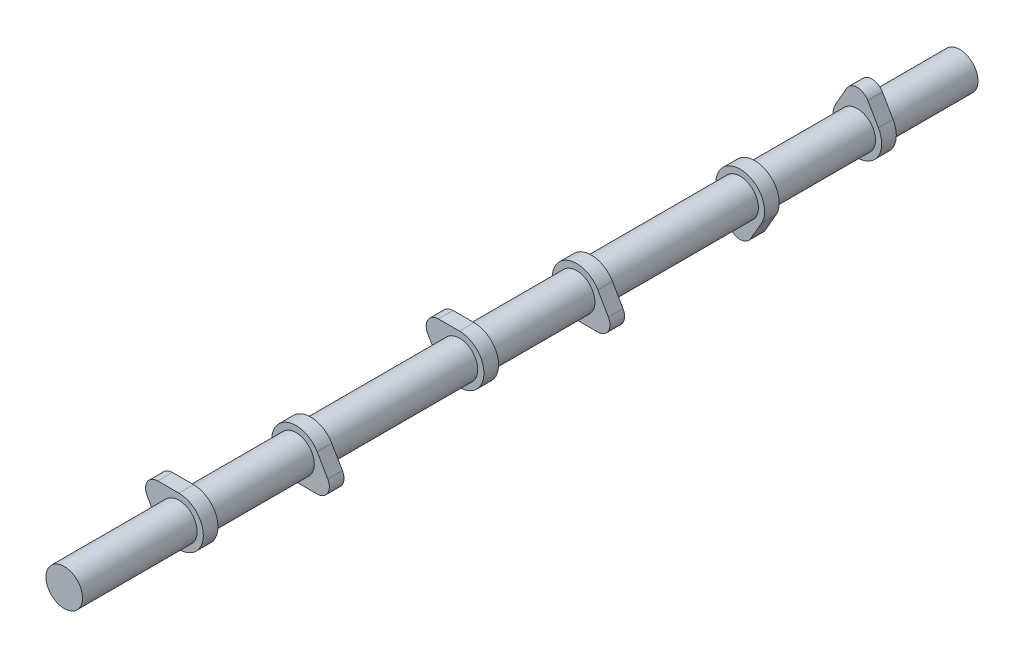
from build123d import *

# Parameters (mm, degrees)
BOSS_EXTRUDE1_DEPTH   = 3.81
BODY_MOVE_COPY2_ANGLE = 180
BOSS_EXTRUDE3_START   = -25.4
SKETCH2_R             = 9.5
BOSS_EXTRUDE3_DEPTH   = 146.05
LPATTERN1_COUNT       = 3
LPATTERN1_PITCH       = 146.05
BODY_MOVE_COPY3_ANGLE = 120
BODY_MOVE_COPY4_ANGLE = 120
MOVE_FACE1_BY         = 27.94


with BuildPart() as part:
    # Sketch1 → Boss-Extrude1 (new, symmetric)
    with BuildSketch(Plane.XY):
        with BuildLine():
            Line((-5.499261314, 15.875), (-10.998522628, 6.35))
            ThreePointArc((-10.998522628, 6.35), (0, -12.7), (10.998522628, 6.35))
            Line((10.998522628, 6.35), (5.499261314, 15.875))
            ThreePointArc((5.499261314, 15.875), (0, 19.05), (-5.499261314, 15.875))
        make_face()
    extrude(amount=BOSS_EXTRUDE1_DEPTH, both=True)


with BuildPart() as body_2:
    # Body-Move/Copy1: copy of part
    add(part.part.moved(Location((0, 0, 60.96))))


with BuildPart() as body_2_1:
    # Body-Move/Copy2: moved
    add(body_2.part.rotate(Axis((0, 0, 0), (0, 0, 1)), BODY_MOVE_COPY2_ANGLE))


with BuildPart() as body_3:
    # Sketch2 → Boss-Extrude3 (new body)
    with BuildSketch(Plane.XY.offset(3.81).offset(BOSS_EXTRUDE3_START)):
        Circle(SKETCH2_R)
    extrude(amount=BOSS_EXTRUDE3_DEPTH)


with BuildPart() as lpattern1_1:
    # LPattern1: pattern copy
    add(body_3.part.moved(Location(Vector(0, 0, 1) * (1 * LPATTERN1_PITCH))))


with BuildPart() as lpattern1_2:
    # LPattern1: pattern copy
    add(body_3.part.moved(Location(Vector(0, 0, 1) * (2 * LPATTERN1_PITCH))))


with BuildPart() as lpattern1_3:
    # LPattern1: pattern copy
    add(part.part.moved(Location(Vector(0, 0, 1) * (1 * LPATTERN1_PITCH))))


with BuildPart() as lpattern1_4:
    # LPattern1: pattern copy
    add(part.part.moved(Location(Vector(0, 0, 1) * (2 * LPATTERN1_PITCH))))


with BuildPart() as lpattern1_5:
    # LPattern1: pattern copy
    add(body_2_1.part.moved(Location(Vector(0, 0, 1) * (1 * LPATTERN1_PITCH))))


with BuildPart() as lpattern1_6:
    # LPattern1: pattern copy
    add(body_2_1.part.moved(Location(Vector(0, 0, 1) * (2 * LPATTERN1_PITCH))))


with BuildPart() as lpattern1_5_1:
    # Body-Move/Copy3: moved
    add(lpattern1_5.part.rotate(Axis((0, 0, 0), (0, 0, -1)), BODY_MOVE_COPY3_ANGLE))


with BuildPart() as lpattern1_3_1:
    # Body-Move/Copy3: moved
    add(lpattern1_3.part.rotate(Axis((0, 0, 0), (0, 0, -1)), BODY_MOVE_COPY3_ANGLE))


with BuildPart() as lpattern1_2_1:
    # Body-Move/Copy4: moved
    add(lpattern1_2.part.rotate(Axis((0, 0, 0), (0, 0, -1)), BODY_MOVE_COPY4_ANGLE))


with BuildPart() as lpattern1_6_1:
    # Body-Move/Copy4: moved
    add(lpattern1_6.part.rotate(Axis((0, 0, 0), (0, 0, -1)), BODY_MOVE_COPY4_ANGLE))


with BuildPart() as lpattern1_4_1:
    # Body-Move/Copy4: moved
    add(lpattern1_4.part.rotate(Axis((0, 0, 0), (0, 0, -1)), BODY_MOVE_COPY4_ANGLE))


with BuildPart() as body_3_1:
    add(body_3.part)

    # Combine1: union LPattern1_4, LPattern1_3, LPattern1_2, LPattern1_1, part, body 2, LPattern1_6, LPattern1_5
    add(lpattern1_4_1.part)
    add(lpattern1_3_1.part)
    add(lpattern1_2_1.part)
    add(lpattern1_1.part)
    add(part.part)
    add(body_2_1.part)
    add(lpattern1_6_1.part)
    add(lpattern1_5_1.part)

    # Move Face1: a face moved outward by 27.94
    extrude(body_3_1.faces().sort_by_distance((0, 0, -21.59))[0], amount=MOVE_FACE1_BY, dir=(0, 0, -1))


solid = body_3_1.part
